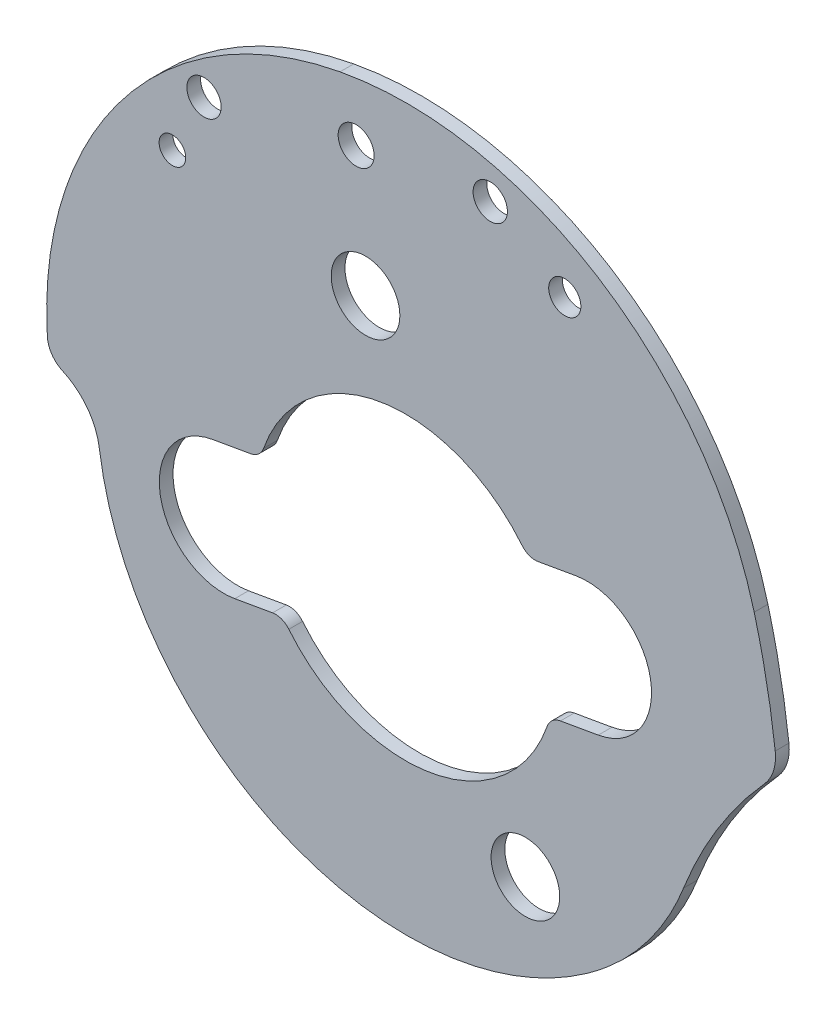
from build123d import *

# Parameters (mm, degrees)
BOSS_EXTRUDE1_DEPTH = 1.6
SKETCH2_R           = 4
SKETCH2_R_2         = 2
SKETCH2_R_3         = 1.551240763
SKETCH2_R_4         = 2.096920304
SKETCH2_R_5         = 1.874340877
CUT_EXTRUDE1_DEPTH  = 1.6
FILLET1_R           = 3
FILLET2_R           = 5


with BuildPart() as part:
    # Model → Boss-Extrude1 (new body)
    with BuildSketch(Plane.XY):
        with BuildLine():
            add(Edge.make_bspline(
                [(44.0581, -11.3354), (38.4033, 9.8661), (17.3587, 23.1222), (-4.2058, 19.0663)],
                knots=[0, 0, 0, 0, 0.333333333, 0.333333333, 0.333333333, 0.333333333], degree=3))
            add(Edge.make_bspline(
                [(-4.2058, 19.0663), (-25.7703, 15.0105), (-40.5609, -4.9853), (-38.1268, -26.7925)],
                knots=[0.333333333, 0.333333333, 0.333333333, 0.333333333, 1, 1, 1, 1], degree=3))
            add(Edge.make_bspline(
                [(-32.2525, -32.9684), (-32.6837, -29.8631), (-35.047, -27.3785), (-38.1268, -26.7925)],
                knots=[0, 0, 0, 0, 1, 1, 1, 1], degree=3))
            add(Edge.make_bspline(
                [(-32.2525, -32.9684), (-30.442, -46.0069), (-21.6996, -57.0365), (-9.4187, -61.7758)],
                knots=[0, 0, 0, 0, 0.333333333, 0.333333333, 0.333333333, 0.333333333], degree=3))
            add(Edge.make_bspline(
                [(-9.4187, -61.7758), (2.8622, -66.5152), (16.7476, -64.218), (26.8478, -55.776)],
                knots=[0.333333333, 0.333333333, 0.333333333, 0.333333333, 1, 1, 1, 1], degree=3))
            add(Edge.make_bspline(
                [(26.8478, -55.776), (30.8425, -52.4371), (33.9303, -48.1443), (35.8253, -43.295)],
                knots=[0, 0, 0, 0, 1, 1, 1, 1], degree=3))
            add(Edge.make_bspline(
                [(46.7562, -26.4745), (42.0043, -31.2778), (38.2846, -37.0019), (35.8253, -43.295)],
                knots=[0, 0, 0, 0, 1, 1, 1, 1], degree=3))
            add(Edge.make_bspline(
                [(46.7562, -26.4745), (46.284, -21.3612), (45.3815, -16.2969), (44.0581, -11.3354)],
                knots=[0, 0, 0, 0, 1, 1, 1, 1], degree=3))
        make_face()
    extrude(amount=BOSS_EXTRUDE1_DEPTH)

    # Sketch2 → Cut-Extrude1 (cut)
    with BuildSketch(Plane.XY.offset(1.6)):
        with Locations((17.3961, -51.3806)):
            Circle(SKETCH2_R)
        with Locations((-1.2327, -2.0433)):
            Circle(SKETCH2_R)
        with Locations((-20.0573, 8.5758)):
            Circle(SKETCH2_R_2)
        with Locations((13.2993, 14.7207)):
            Circle(SKETCH2_R_2)
        with Locations((-23.737719808, 1.389021653)):
            Circle(SKETCH2_R_3)
        with Locations((-2.328258131, 12.576412767)):
            Circle(SKETCH2_R_4)
        with Locations((21.984264555, 9.420615455)):
            Circle(SKETCH2_R_5)
        with BuildLine():
            Line((-19.056077425, -25.461514873), (-14.652380487, -24.690905022))
            ThreePointArc((-14.652380487, -24.690905022), (-13.702265565, -24.245091556), (-13.108712216, -23.379549857))
            ThreePointArc((-13.108712216, -23.379549857), (0.398385158, -11.905192157), (16.999343908, -18.110893783))
            ThreePointArc((16.999343908, -18.110893783), (17.85155014, -18.723439741), (18.896596337, -18.820116826))
            Line((18.896596337, -18.820116826), (23.300293275, -18.049506976))
            ThreePointArc((23.300293275, -18.049506976), (31.980824426, -24.144453977), (25.885877425, -32.824985127))
            Line((25.885877425, -32.824985127), (21.482180487, -33.595594978))
            ThreePointArc((21.482180487, -33.595594978), (20.532065565, -34.041408444), (19.938512216, -34.906950143))
            ThreePointArc((19.938512216, -34.906950143), (6.431414842, -46.381307843), (-10.169543908, -40.175606217))
            ThreePointArc((-10.169543908, -40.175606217), (-11.02175014, -39.563060259), (-12.066796337, -39.466383174))
            Line((-12.066796337, -39.466383174), (-16.470493275, -40.236993024))
            ThreePointArc((-16.470493275, -40.236993024), (-25.151024426, -34.142046023), (-19.056077425, -25.461514873))
        make_face()
    extrude(amount=-CUT_EXTRUDE1_DEPTH, mode=Mode.SUBTRACT)

    # Fillet1
    fillet1_edges = [part.edges().sort_by_distance(p)[0] for p in [
        (-38.1268, -26.7925, 0.8),
    ]]
    fillet(fillet1_edges, radius=FILLET1_R)

    # Fillet2
    fillet2_edges = [part.edges().sort_by_distance(p)[0] for p in [
        (46.7562, -26.4745, 0.8),
    ]]
    fillet(fillet2_edges, radius=FILLET2_R)


solid = part.part
